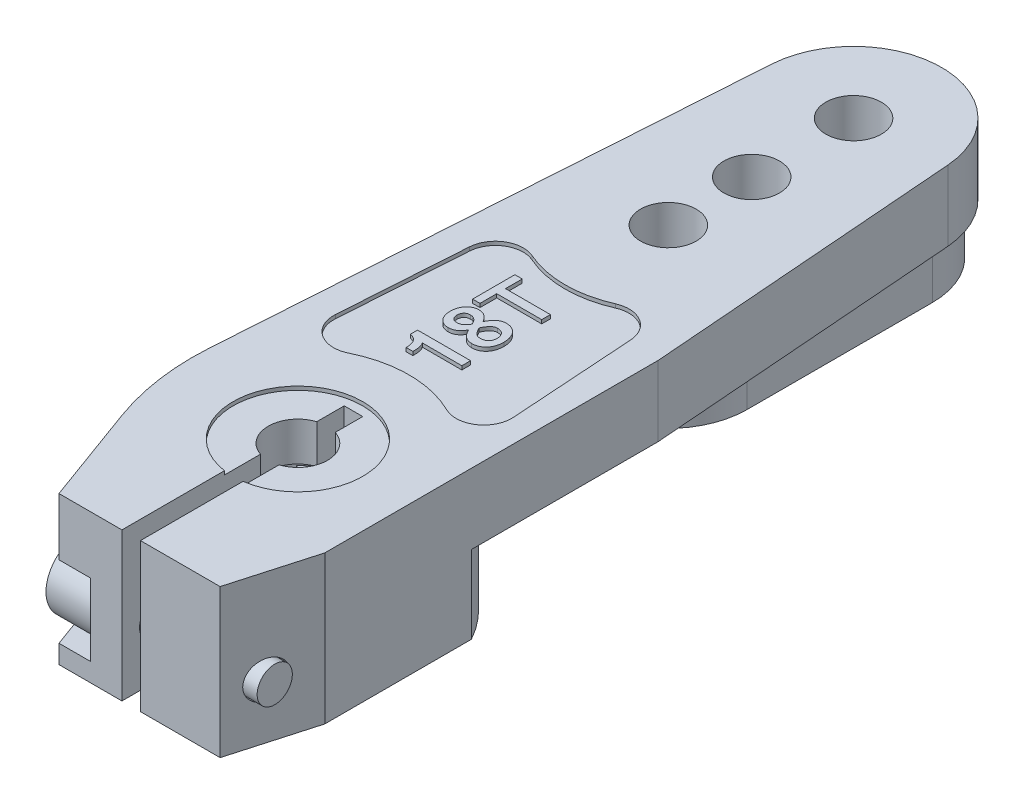
from build123d import *

# Parameters (mm, degrees)
ESQUISSE2_R                  = 6.75
BOSS_EXTRU_1_DEPTH           = 8
ESQUISSE3_R                  = 3.9
ENL_V_MAT_EXTRU_1_DEPTH      = 5.7
BOSS_EXTRU_2_DEPTH           = 4
R_P_TITION_CIRCULAIRE1_COUNT = 18
ESQUISSE5_R                  = 1.5
ESQUISSE5_R_2                = 4.125
BOSS_EXTRU_3_DEPTH           = 8
ESQUISSE6_W                  = 5.995116734
ESQUISSE6_H                  = 5.986651818
ENL_V_MAT_EXTRU_2_DEPTH      = 8
CONG_1_R                     = 13.5
ENL_V_START                  = -1.5
ENL_V_MAT_EXTRU_5_DEPTH      = 1.5
ENL_V_START_2                = -2.7
ENL_V_MAT_EXTRU_6_DEPTH      = 2.7
ESQUISSE9_W                  = 2
ESQUISSE9_H                  = 9.04292369
BOSS_EXTRU_4_DEPTH           = 2.7
CONG_2_R                     = 2
ESQUISSE10_R                 = 1.6
ENL_V_MAT_EXTRU_7_DEPTH      = 4
ESQUISSE11_W                 = 1
ESQUISSE11_H                 = 12
ENL_V_MAT_EXTRU_8_DEPTH      = 8
ESQUISSE12_R                 = 3.5
ENL_V_MAT_EXTRU_9_DEPTH      = 0.2
ENL_V_MAT_EXTRU_10_DEPTH     = 5
ESQUISSE14_R                 = 1
ENL_V_MAT_EXTRU_11_DEPTH     = 9
ENL_V_MAT_EXTRU_12_DEPTH     = 0.2
BOSS_EXTRU_5_DEPTH           = 0.2
ESQUISSE17_R                 = 1.85
BOSS_EXTRU_6_DEPTH           = 2.5
ENL_V_MAT_EXTRU_13_DEPTH     = 1.5
ESQUISSE19_R                 = 0.95
BOSS_EXTRU_7_DEPTH           = 8


with BuildPart() as part:
    # Esquisse2 → Boss.-Extru.1 (new body)
    with BuildSketch(Plane(origin=(0, 0, 0), x_dir=(1, 0, 0), z_dir=(0, 1, 0))):
        with Locations(Location((0, 0, 0), (0, 0, 270))):
            Circle(ESQUISSE2_R)
    extrude(amount=BOSS_EXTRU_1_DEPTH)

    # Esquisse3 → Enlèv. mat.-Extru.1 (cut)
    with BuildSketch(Plane.XZ):
        with Locations(Location((0, 0, 0), (0, 0, 270))):
            Circle(ESQUISSE3_R)
    extrude(amount=-ENL_V_MAT_EXTRU_1_DEPTH, mode=Mode.SUBTRACT)

    # Esquisse4 → Boss.-Extru.2 (add)
    with BuildSketch(Plane.XZ):
        Polygon((-0.4, 3.9), (0.4, 3.9), (0.15, 3.2), (-0.15, 3.2), align=None)
    boss_extru_2 = extrude(amount=-BOSS_EXTRU_2_DEPTH)

    # Répétition circulaire1: Boss.-Extru.2 ×18 about axis
    r_p_tition_circulaire1_axis = Axis((0, 0, 0), (0, 1, 0))
    for i in range(1, R_P_TITION_CIRCULAIRE1_COUNT):
        add(boss_extru_2.rotate(r_p_tition_circulaire1_axis, i * 360 / R_P_TITION_CIRCULAIRE1_COUNT))

    # Esquisse5 → Boss.-Extru.3 (add)
    with BuildSketch(Plane(origin=(0, 8, 0), x_dir=(1, 0, 0), z_dir=(0, 1, 0))):
        with BuildLine():
            Line((-3.9, -9), (4.8, -9))
            Line((4.8, -9), (6.05, -4.6))
            Line((6.05, -4.6), (6.05, 13.4))
            Line((6.05, 13.4), (4.735815077, 30.366818146))
            ThreePointArc((4.735815077, 30.366818146), (-0.025140893, 34.749933466), (-4.73943269, 30.316666667))
            Line((-4.73943269, 30.316666667), (-6.830137326, -0.974135115))
            Line((-6.830137326, -0.974135115), (-3.9, -9))
        make_face()
        with Locations(Location((0, 30, 0), (0, 0, 270))):
            Circle(ESQUISSE5_R, mode=Mode.SUBTRACT)
        with Locations(Location((0, 24.5, 0), (0, 0, 270))):
            Circle(ESQUISSE5_R, mode=Mode.SUBTRACT)
        with Locations(Location((0, 20, 0), (0, 0, 270))):
            Circle(ESQUISSE5_R, mode=Mode.SUBTRACT)
        Circle(ESQUISSE5_R_2, mode=Mode.SUBTRACT)
    extrude(amount=-BOSS_EXTRU_3_DEPTH)

    # Esquisse6 → Enlèv. mat.-Extru.2 (cut)
    with BuildSketch(Plane.XZ):
        with Locations((9.047558367, 0)):
            Rectangle(ESQUISSE6_W, ESQUISSE6_H)
    extrude(amount=-ENL_V_MAT_EXTRU_2_DEPTH, mode=Mode.SUBTRACT)

    # Congé1
    cong_1_edges = [part.edges().sort_by_distance(p)[0] for p in [
        (-6.830137326, 4, 0.974135115),
    ]]
    fillet(cong_1_edges, radius=CONG_1_R)

    # Esquisse7 → Enlèv. mat.-Extru.5 (cut)
    with BuildSketch(Plane.XZ.offset(ENL_V_START)):
        with BuildLine():
            Line((-6.639829266, -1.874135115), (-4.73943269, -30.316666667))
            ThreePointArc((-4.73943269, -30.316666667), (-0.025140893, -34.749933466), (4.735815077, -30.366818146))
            Line((4.735815077, -30.366818146), (6.05, -13.4))
            Line((6.05, -13.4), (6.05, -3.316204926))
            ThreePointArc((6.05, -3.316204926), (-0.779016031, -6.85513305), (-6.639829266, -1.874135115))
        make_face()
    extrude(amount=ENL_V_MAT_EXTRU_5_DEPTH, mode=Mode.SUBTRACT)

    # Esquisse8 → Enlèv. mat.-Extru.6 (cut)
    with BuildSketch(Plane.XZ.offset(-1.5).offset(ENL_V_START_2)):
        with BuildLine():
            Line((-6.639829266, -1.874135115), (-4.73943269, -30.316666667))
            ThreePointArc((-4.73943269, -30.316666667), (-0.025140893, -34.749933466), (4.735815077, -30.366818146))
            Line((4.735815077, -30.366818146), (6.05, -13.4))
            Line((6.05, -13.4), (6.05, -3.316204926))
            ThreePointArc((6.05, -3.316204926), (-0.779016031, -6.85513305), (-6.639829266, -1.874135115))
        make_face()
        with BuildLine():
            Line((-4.25, -30), (-4.25, -20))
            ThreePointArc((-4.25, -20), (0, -15.75), (4.25, -20))
            Line((4.25, -20), (4.25, -30))
            ThreePointArc((4.25, -30), (0, -34.25), (-4.25, -30))
        make_face(mode=Mode.SUBTRACT)
    extrude(amount=ENL_V_MAT_EXTRU_6_DEPTH, mode=Mode.SUBTRACT)

    # Esquisse9 → Boss.-Extru.4 (add)
    with BuildSketch(Plane.XZ.offset(-1.5)):
        with Locations((0, -11.347860245)):
            Rectangle(ESQUISSE9_W, ESQUISSE9_H)
    extrude(amount=-BOSS_EXTRU_4_DEPTH)

    # Congé2
    cong_2_edges = [part.edges().sort_by_distance(p)[0] for p in [
        (-1, 2.85, -15.86932209),
        (-1, 2.85, -6.8263984),
        (1, 2.85, -6.8263984),
        (1, 2.85, -15.86932209),
    ]]
    fillet(cong_2_edges, radius=CONG_2_R)

    # Esquisse10 → Enlèv. mat.-Extru.7 (cut)
    with BuildSketch(Plane.XZ.offset(-5.7)):
        with Locations(Location((0, 0, 0), (0, 0, 270))):
            Circle(ESQUISSE10_R)
    extrude(amount=-ENL_V_MAT_EXTRU_7_DEPTH, mode=Mode.SUBTRACT)

    # Esquisse11 → Enlèv. mat.-Extru.8 (cut)
    with BuildSketch(Plane.XZ.offset(-8)):
        with Locations((0, 3)):
            Rectangle(ESQUISSE11_W, ESQUISSE11_H)
    extrude(amount=ENL_V_MAT_EXTRU_8_DEPTH, mode=Mode.SUBTRACT)

    # Esquisse12 → Enlèv. mat.-Extru.9 (cut)
    with BuildSketch(Plane(origin=(0, 8, 0), x_dir=(1, 0, 0), z_dir=(0, 1, 0))):
        Circle(ESQUISSE12_R)
    extrude(amount=-ENL_V_MAT_EXTRU_9_DEPTH, mode=Mode.SUBTRACT)

    # Esquisse13 → Enlèv. mat.-Extru.10 (cut)
    with BuildSketch(Plane(origin=(-2.2, 0, 0), x_dir=(0, 0, -1), z_dir=(1, 0, 0))):
        with BuildLine():
            Line((-9, 4.9), (-7.05, 4.9))
            ThreePointArc((-7.05, 4.9), (-5.1, 2.95), (-7.05, 1))
            Line((-7.05, 1), (-9, 1))
            Line((-9, 1), (-9, 4.9))
        make_face()
    extrude(amount=-ENL_V_MAT_EXTRU_10_DEPTH, mode=Mode.SUBTRACT)

    # Esquisse14 → Enlèv. mat.-Extru.11 (cut)
    with BuildSketch(Plane.ZY.offset(2.2)):
        with Locations((7.05, 2.95)):
            Circle(ESQUISSE14_R)
    extrude(amount=-ENL_V_MAT_EXTRU_11_DEPTH, mode=Mode.SUBTRACT)

    # Esquisse15 → Enlèv. mat.-Extru.12 (cut)
    with BuildSketch(Plane(origin=(0, 8, 0), x_dir=(1, 0, 0), z_dir=(0, 1, 0))):
        with BuildLine():
            Line((-4.80530764, 6.830740698), (-4.351676574, 13.620068806))
            ThreePointArc((-4.351676574, 13.620068806), (-3.632048344, 14.803118702), (-2.250223577, 14.892741019))
            ThreePointArc((-2.250223577, 14.892741019), (0, 14.418996466), (2.250223577, 14.892741019))
            ThreePointArc((2.250223577, 14.892741019), (3.632048344, 14.803118702), (4.351676574, 13.620068806))
            Line((4.351676574, 13.620068806), (4.80530764, 6.830740698))
            ThreePointArc((4.80530764, 6.830740698), (4.143578703, 5.484592559), (2.646915748, 5.384592559))
            ThreePointArc((2.646915748, 5.384592559), (0, 6), (-2.646915748, 5.384592559))
            ThreePointArc((-2.646915748, 5.384592559), (-4.143578703, 5.484592559), (-4.80530764, 6.830740698))
        make_face()
    extrude(amount=-ENL_V_MAT_EXTRU_12_DEPTH, mode=Mode.SUBTRACT)

    # Esquisse16 → Boss.-Extru.5 (add)
    # profile 1 of 3: a face of its own
    with BuildSketch(Plane(origin=(0, 7.8, 0), x_dir=(1, 0, 0), z_dir=(0, 1, 0))):
        with BuildLine():
            Line((1, 8.322493904), (1, 7.851635479))
            Line((1, 7.851635479), (-1.138104726, 7.851635479))
            add(Edge.make_bspline(
                [(-1.138104726, 7.851635479), (-1.126290169, 7.838231001), (-1.101092089, 7.809641939), (-1.071485001, 7.7556819), (-1.047259103, 7.690486808), (-1.026262369, 7.614406972), (-1.011031366, 7.526827396), (-0.99992078, 7.427990728), (-0.993243156, 7.317672101), (-0.992488664, 7.240245997), (-0.992093339, 7.199677658)],
                knots=[0, 0, 0, 0, 0.627434204, 1.338191274, 2.149574022, 3.072626793, 4.111948077, 5.274911735, 6.572157227, 8, 8, 8, 8], degree=3))
            Line((-0.992093339, 7.199677658), (-1.354292128, 7.199677658))
            add(Edge.make_bspline(
                [(-1.354292128, 7.199677658), (-1.354482106, 7.225916806), (-1.354851716, 7.276966184), (-1.36161989, 7.351160286), (-1.37064247, 7.421243769), (-1.385139825, 7.486719665), (-1.402258412, 7.548470843), (-1.424623859, 7.605414342), (-1.449716287, 7.658720348), (-1.480270833, 7.706751913), (-1.51337783, 7.751586616), (-1.551827889, 7.790962491), (-1.593167659, 7.827284292), (-1.639236245, 7.858147786), (-1.689062951, 7.885092785), (-1.742731213, 7.907531641), (-1.800505878, 7.925919598), (-1.840720189, 7.934423016), (-1.861370432, 7.938789562)],
                knots=[0, 0, 0, 0, 1.273910712, 2.478447484, 3.616171913, 4.703447937, 5.732977344, 6.725005322, 7.671649268, 8.589474749, 9.485593469, 10.37342943, 11.256952376, 12.154054273, 13.060095749, 14.004564366, 14.975334121, 16, 16, 16, 16], degree=3))
            Line((-1.861370432, 7.938789562), (-1.861370432, 8.322493904))
            Line((-1.861370432, 8.322493904), (1, 8.322493904))
        make_face()
    # profile 2 of 3: a face of its own
    with BuildSketch(Plane(origin=(0, 7.8, 0), x_dir=(1, 0, 0), z_dir=(0, 1, 0))):
        with BuildLine():
            add(Edge.make_bspline(
                [(-0.490674391, 10.479274505), (-0.480201632, 10.502051637), (-0.459675123, 10.546694601), (-0.424829072, 10.609822897), (-0.389192679, 10.669076818), (-0.351954112, 10.723996675), (-0.312912222, 10.774546165), (-0.272106403, 10.820340532), (-0.230001547, 10.862214546), (-0.185963738, 10.899305753), (-0.140468745, 10.932675277), (-0.092938603, 10.960788718), (-0.04387676, 10.984699437), (0.006541374, 11.004756712), (0.05892136, 11.019817039), (0.112552138, 11.031460337), (0.168122319, 11.037550225), (0.205602198, 11.038501107), (0.224668218, 11.038984821)],
                knots=[0, 0, 0, 0, 1.245960069, 2.442070028, 3.582463538, 4.682816914, 5.738996933, 6.755410803, 7.730302695, 8.688586882, 9.615326988, 10.532142902, 11.429761432, 12.326693746, 13.225927712, 14.136437779, 15.052005606, 16, 16, 16, 16], degree=3))
            add(Edge.make_bspline(
                [(0.224668218, 11.038984821), (0.253390745, 11.038297999), (0.309983932, 11.036944724), (0.392665502, 11.024056365), (0.471698135, 11.003790879), (0.546614741, 10.974700497), (0.618038763, 10.937620323), (0.685461683, 10.892271838), (0.74877411, 10.838312839), (0.807900877, 10.777020149), (0.861299211, 10.708606786), (0.908970417, 10.634934363), (0.947482942, 10.554866319), (0.981044182, 10.470441345), (1.005431447, 10.379757963), (1.023570102, 10.284059454), (1.0345117, 10.182789516), (1.035641169, 10.113518678), (1.036219879, 10.078026159)],
                knots=[0, 0, 0, 0, 0.9765063, 1.924050899, 2.839315968, 3.747466153, 4.651639434, 5.571863379, 6.505329277, 7.476612846, 8.463878079, 9.453705559, 10.455362419, 11.481473345, 12.540218754, 13.644061481, 14.792880327, 16, 16, 16, 16], degree=3))
            add(Edge.make_bspline(
                [(1.036219879, 10.078026159), (1.035646489, 10.044604619), (1.034522493, 9.979089513), (1.023410359, 9.883349552), (1.006052282, 9.792472573), (0.98178642, 9.706352106), (0.949874027, 9.625161299), (0.911415994, 9.548507288), (0.865983093, 9.476635965), (0.813329149, 9.410686051), (0.755359121, 9.35095357), (0.692971393, 9.298184843), (0.625368546, 9.25455907), (0.553949483, 9.217769099), (0.477474712, 9.190445204), (0.397260094, 9.169648922), (0.312367368, 9.157754119), (0.254321625, 9.156296012), (0.224668218, 9.155551119)],
                knots=[0, 0, 0, 0, 1.161397019, 2.276646994, 3.345407192, 4.375002425, 5.382110322, 6.373379631, 7.352140653, 8.332262804, 9.301508956, 10.241907306, 11.165905522, 12.092668848, 13.028322139, 13.982633908, 14.969402809, 16, 16, 16, 16], degree=3))
            add(Edge.make_bspline(
                [(0.224668218, 9.155551119), (0.205224929, 9.156034208), (0.166992589, 9.156984133), (0.110300086, 9.16308623), (0.0557026, 9.174637564), (0.002586754, 9.18978), (-0.048385733, 9.209850084), (-0.097917625, 9.23359745), (-0.145553867, 9.26187757), (-0.191058013, 9.295226643), (-0.235100449, 9.332317768), (-0.277176209, 9.374214203), (-0.318023314, 9.419827955), (-0.356474263, 9.470569603), (-0.393084827, 9.525508227), (-0.428431537, 9.584418665), (-0.461127331, 9.648186188), (-0.481415257, 9.692542936), (-0.491806262, 9.715261434)],
                knots=[0, 0, 0, 0, 0.963790263, 1.895150465, 2.821191928, 3.726660079, 4.629565967, 5.532859077, 6.446879996, 7.370794852, 8.326157625, 9.298077471, 10.311392714, 11.358650017, 12.450416381, 13.582517057, 14.761821287, 16, 16, 16, 16], degree=3))
            add(Edge.make_bspline(
                [(-0.491806262, 9.715261434), (-0.511972379, 9.679497682), (-0.550889288, 9.610480196), (-0.61992945, 9.518189355), (-0.694268265, 9.439654017), (-0.774710713, 9.375390157), (-0.860941723, 9.325473149), (-0.952976128, 9.290122472), (-1.050622445, 9.267613429), (-1.11798416, 9.265358106), (-1.152253116, 9.264210755)],
                knots=[0, 0, 0, 0, 1.166241735, 2.250632781, 3.267191642, 4.232895384, 5.167496548, 6.087739132, 7.027174671, 8, 8, 8, 8], degree=3))
            add(Edge.make_bspline(
                [(-1.152253116, 9.264210755), (-1.17776416, 9.26477193), (-1.227704365, 9.26587048), (-1.300662595, 9.277174774), (-1.370238135, 9.294417609), (-1.436173348, 9.319653313), (-1.498706021, 9.351333928), (-1.557586515, 9.390236864), (-1.61270373, 9.436470824), (-1.663911305, 9.489397516), (-1.709978081, 9.548239738), (-1.751071667, 9.611010105), (-1.785376453, 9.678583992), (-1.812683417, 9.750652619), (-1.835215827, 9.82658945), (-1.849923006, 9.907049188), (-1.860183114, 9.991549527), (-1.860968594, 10.049507649), (-1.861370432, 10.07915803)],
                knots=[0, 0, 0, 0, 1.009420384, 1.976032798, 2.916310017, 3.843048761, 4.765079234, 5.687018927, 6.630997748, 7.608288114, 8.597580319, 9.585884994, 10.574725879, 11.591553892, 12.634041316, 13.70642152, 14.82664461, 16, 16, 16, 16], degree=3))
            add(Edge.make_bspline(
                [(-1.861370432, 10.07915803), (-1.860720048, 10.110689732), (-1.859451176, 10.172206659), (-1.849517215, 10.262047522), (-1.834177868, 10.347201811), (-1.81112676, 10.427104172), (-1.783219495, 10.502773165), (-1.747138935, 10.572731635), (-1.705759025, 10.638648764), (-1.657768197, 10.698664116), (-1.605426173, 10.752829335), (-1.549544445, 10.800305744), (-1.490607125, 10.840605972), (-1.428704741, 10.873858479), (-1.363514072, 10.898709245), (-1.295817468, 10.916758465), (-1.225118914, 10.928784917), (-1.176827217, 10.929805727), (-1.152253116, 10.930325184)],
                knots=[0, 0, 0, 0, 1.220363379, 2.380873854, 3.495223222, 4.565558459, 5.596373726, 6.612100599, 7.606844653, 8.604800329, 9.58089982, 10.518769303, 11.43837804, 12.340066041, 13.232449612, 14.132361468, 15.049618447, 16, 16, 16, 16], degree=3))
            add(Edge.make_bspline(
                [(-1.152253116, 10.930325184), (-1.118924904, 10.929162233), (-1.053055282, 10.926863786), (-0.957154132, 10.90422667), (-0.865889378, 10.868955183), (-0.779713188, 10.819017779), (-0.698762936, 10.754772846), (-0.623288579, 10.676292962), (-0.552650361, 10.583886507), (-0.511847715, 10.515013903), (-0.490674391, 10.479274505)],
                knots=[0, 0, 0, 0, 0.947514598, 1.872660545, 2.789301131, 3.725328423, 4.696717264, 5.722280716, 6.818045033, 8, 8, 8, 8], degree=3))
        make_face()
        with BuildLine():
            add(Edge.make_bspline(
                [(-0.666114429, 10.084817386), (-0.681060187, 10.114341686), (-0.709740989, 10.170998604), (-0.759319497, 10.247992957), (-0.813761177, 10.312750089), (-0.871173925, 10.3666753), (-0.933397749, 10.40822733), (-0.999228817, 10.438154772), (-1.069396869, 10.456473837), (-1.117622094, 10.458460014), (-1.142066275, 10.459466759)],
                knots=[0, 0, 0, 0, 1.236941387, 2.373681631, 3.415044518, 4.393488928, 5.309093177, 6.199375763, 7.087307838, 8, 8, 8, 8], degree=3))
            add(Edge.make_bspline(
                [(-1.142066275, 10.459466759), (-1.168787077, 10.458394998), (-1.219933913, 10.456343518), (-1.292040753, 10.437407961), (-1.354944939, 10.405962811), (-1.40728369, 10.361248034), (-1.449493863, 10.305683273), (-1.478040503, 10.238364509), (-1.496753724, 10.161666291), (-1.498339145, 10.106823764), (-1.499171643, 10.078026159)],
                knots=[0, 0, 0, 0, 1.079180963, 2.065682493, 2.990494969, 3.900103664, 4.826457363, 5.786395277, 6.837644453, 8, 8, 8, 8], degree=3))
            add(Edge.make_bspline(
                [(-1.499171643, 10.078026159), (-1.498149733, 10.053213962), (-1.496190234, 10.005636901), (-1.479509222, 9.938194427), (-1.451966294, 9.878394309), (-1.413247277, 9.826526494), (-1.361982096, 9.784603783), (-1.298620592, 9.7552261), (-1.223936641, 9.737608728), (-1.170468589, 9.735950196), (-1.142066275, 9.735069181)],
                knots=[0, 0, 0, 0, 1.055447159, 2.023806009, 2.93669316, 3.842874988, 4.756292199, 5.726482069, 6.792303693, 8, 8, 8, 8], degree=3))
            add(Edge.make_bspline(
                [(-1.142066275, 9.735069181), (-1.116875546, 9.736123398), (-1.06763287, 9.738184176), (-0.996222964, 9.755412601), (-0.929071721, 9.782526936), (-0.867054331, 9.82188687), (-0.80884134, 9.871340116), (-0.756076838, 9.932349399), (-0.707333955, 10.00401244), (-0.680239933, 10.057126369), (-0.666114429, 10.084817386)],
                knots=[0, 0, 0, 0, 0.964264736, 1.884938517, 2.799231708, 3.728044699, 4.687091573, 5.716785196, 6.809642903, 8, 8, 8, 8], degree=3))
        make_face(mode=Mode.SUBTRACT)
        with BuildLine():
            add(Edge.make_bspline(
                [(0.215613248, 10.568126395), (0.189406002, 10.566799362), (0.137899314, 10.564191263), (0.063619532, 10.540703213), (-0.005360547, 10.503518364), (-0.068721477, 10.449919791), (-0.128406686, 10.381089537), (-0.188323334, 10.297587937), (-0.247487586, 10.197196903), (-0.284377009, 10.123729625), (-0.30391564, 10.084817386)],
                knots=[0, 0, 0, 0, 0.83590887, 1.642862361, 2.465880644, 3.326823024, 4.279373314, 5.372312444, 6.608234713, 8, 8, 8, 8], degree=3))
            add(Edge.make_bspline(
                [(-0.30391564, 10.084817386), (-0.285653553, 10.049319014), (-0.250812918, 9.98159478), (-0.194643763, 9.888400411), (-0.136716845, 9.809362341), (-0.078514192, 9.74253517), (-0.015215047, 9.689385157), (0.055727594, 9.652858175), (0.133520887, 9.630371407), (0.187726965, 9.627755365), (0.215613248, 9.626409544)],
                knots=[0, 0, 0, 0, 1.303990237, 2.487768704, 3.550299984, 4.501735284, 5.377639219, 6.232142957, 7.090527044, 8, 8, 8, 8], degree=3))
            add(Edge.make_bspline(
                [(0.215613248, 9.626409544), (0.233921431, 9.626932307), (0.269494053, 9.627948032), (0.321293004, 9.63326641), (0.369294174, 9.64369079), (0.414253875, 9.657059549), (0.455303448, 9.675256621), (0.493476443, 9.696948696), (0.527789168, 9.7229343), (0.558669561, 9.752655144), (0.585601321, 9.785583556), (0.609642514, 9.820627086), (0.629387165, 9.858368027), (0.645902278, 9.897883799), (0.658424622, 9.939835427), (0.66723295, 9.983793617), (0.673290848, 10.030132284), (0.673773419, 10.061782325), (0.67402109, 10.078026159)],
                knots=[0, 0, 0, 0, 1.205490439, 2.34225627, 3.421123007, 4.434474719, 5.424195111, 6.369859614, 7.318535666, 8.249410413, 9.184251973, 10.114132372, 11.041771592, 11.982613956, 12.929337662, 13.918044914, 14.931472701, 16, 16, 16, 16], degree=3))
            add(Edge.make_bspline(
                [(0.67402109, 10.078026159), (0.673753167, 10.096151528), (0.67322987, 10.13155323), (0.667457648, 10.183239268), (0.657877001, 10.232297573), (0.64432802, 10.278479752), (0.627396797, 10.322021561), (0.606127857, 10.362482585), (0.581497432, 10.40053252), (0.552356088, 10.434833074), (0.520755425, 10.466434489), (0.485467383, 10.493291702), (0.447910612, 10.517146323), (0.406778303, 10.535512555), (0.363089497, 10.550504203), (0.316324868, 10.560390714), (0.26691341, 10.566800411), (0.232989696, 10.567677257), (0.215613248, 10.568126395)],
                knots=[0, 0, 0, 0, 1.146024369, 2.23836625, 3.284368458, 4.303832929, 5.27875259, 6.234052375, 7.190469252, 8.139188934, 9.075750366, 10.011323182, 10.938411808, 11.883447713, 12.853169327, 13.854883026, 14.901225451, 16, 16, 16, 16], degree=3))
        make_face(mode=Mode.SUBTRACT)
    # profile 3 of 3: a face of its own
    with BuildSketch(Plane(origin=(0, 7.8, 0), x_dir=(1, 0, 0), z_dir=(0, 1, 0))):
        Polygon((-1.426731886, 13.538156464), (-1.426731886, 12.632659492), (1, 12.632659492), (1, 12.161801066), (-1.426731886, 12.161801066), (-1.426731886, 11.256304094), (-1.825150553, 11.256304094), (-1.825150553, 13.538156464), align=None)
    extrude(amount=BOSS_EXTRU_5_DEPTH)

    # Esquisse17 → Boss.-Extru.6 (add)
    with BuildSketch(Plane.ZY.offset(2.2)):
        with Locations((7.05, 2.95)):
            Circle(ESQUISSE17_R)
    extrude(amount=BOSS_EXTRU_6_DEPTH)

    # Esquisse18 → Enlèv. mat.-Extru.13 (cut)
    with BuildSketch(Plane.ZY.offset(4.7)):
        Polygon((7.627350269, 1.95), (8.204700538, 2.95), (7.627350269, 3.95), (6.472649731, 3.95), (5.895299462, 2.95), (6.472649731, 1.95), align=None)
    extrude(amount=-ENL_V_MAT_EXTRU_13_DEPTH, mode=Mode.SUBTRACT)

    # Esquisse19 → Boss.-Extru.7 (add)
    with BuildSketch(Plane(origin=(-2.2, 0, 0), x_dir=(0, 0, -1), z_dir=(1, 0, 0))):
        with Locations(Location((-7.05, 2.95, 0), (0, 0, 180))):
            Circle(ESQUISSE19_R)
    extrude(amount=BOSS_EXTRU_7_DEPTH)


solid = part.part
